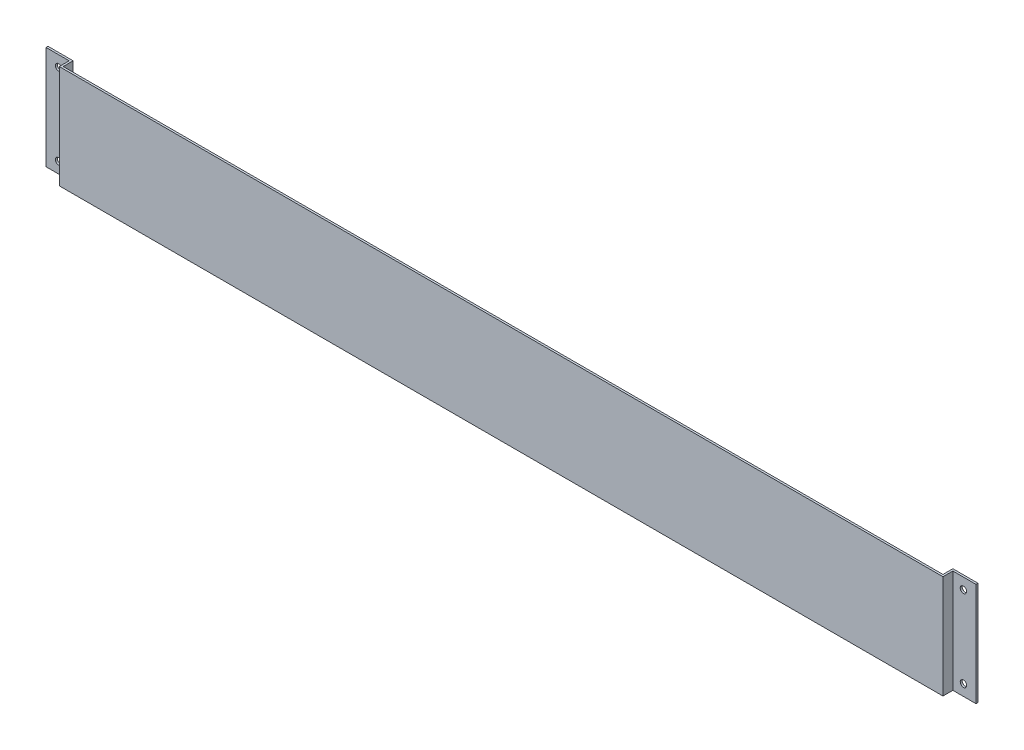
from build123d import *

# Parameters (mm, degrees)
BOSS_EXTRUDE1_DEPTH = 104.45
SKETCH2_R           = 3.25
CUT_EXTRUDE1_DEPTH  = 946.639382904


with BuildPart() as part:
    # Sketch1 → Boss-Extrude1 (new body)
    with BuildSketch(Plane(origin=(0, 0, 0), x_dir=(1, 0, 0), z_dir=(0, 1, 0))):
        Polygon((916.4, 30.468956062), (23.4, 30.468956062), (23.4, 40.468956062), (0, 40.468956062), (0, 42.468956062), (25.4, 42.468956062), (25.4, 32.468956062), (914.4, 32.468956062), (914.4, 42.468956062), (939.8, 42.468956062), (939.8, 40.468956062), (916.4, 40.468956062), align=None)
    extrude(amount=BOSS_EXTRUDE1_DEPTH)

    # Sketch2 → Cut-Extrude1 (cut, through all)
    with BuildSketch(Plane.XY.offset(-40.468956062)):
        with Locations((927.1, 11.11)):
            Circle(SKETCH2_R)
        with Locations((927.1, 93.34)):
            Circle(SKETCH2_R)
        with Locations((12.7, 11.11)):
            Circle(SKETCH2_R)
        with Locations((12.7, 93.34)):
            Circle(SKETCH2_R)
    extrude(amount=-CUT_EXTRUDE1_DEPTH, mode=Mode.SUBTRACT)


solid = part.part
